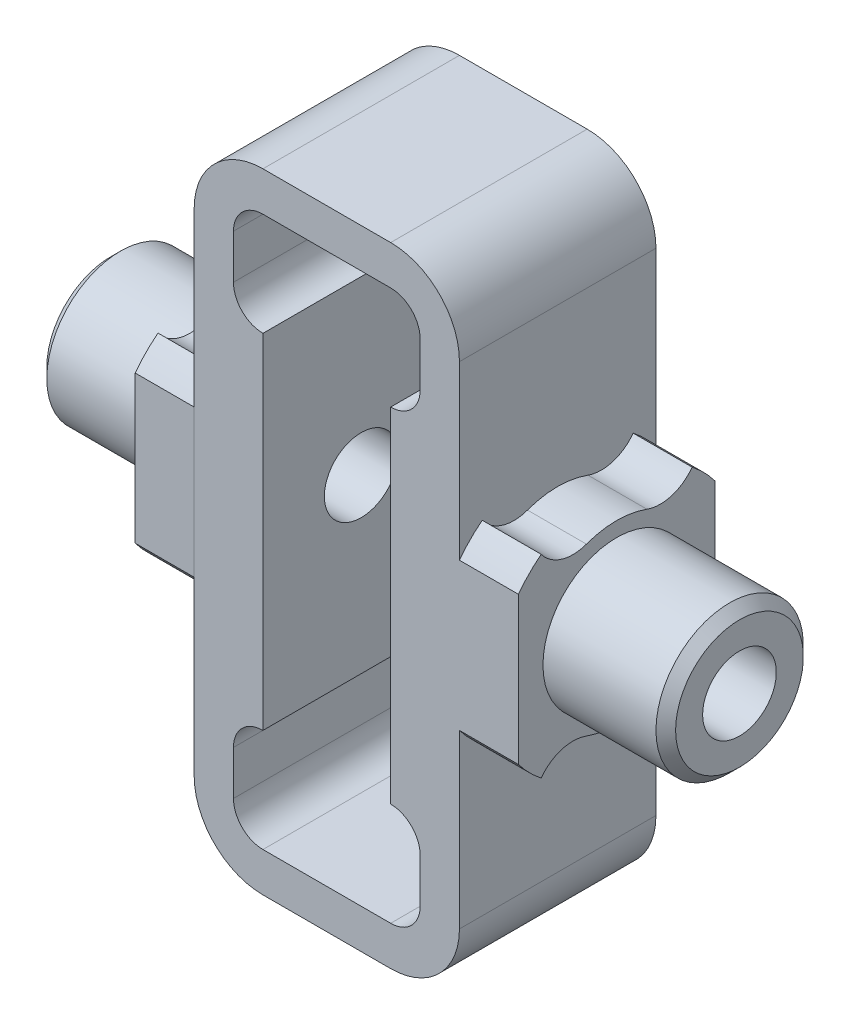
from build123d import *

# Parameters (mm, degrees)
BOSS_EXTRUDE1_DEPTH      = 20
CUT_EXTRUDE1_DEPTH       = 40
BOSS_EXTRUDE2_DEPTH      = 12
SKETCH5_R                = 15
BOSS_EXTRUDE3_DEPTH      = 25
CHAMFER1_SIZE            = 2
CHAMFER1_OF_MIRROR2_SIZE = 2


with BuildPart() as part:
    # Sketch1 → Boss-Extrude1 (new, symmetric)
    with BuildSketch(Plane.XY):
        with BuildLine():
            Line((0, 64), (-13, 64))
            ThreePointArc((-13, 64), (-22.899494937, 59.899494937), (-27, 50))
            Line((-27, 50), (-27, -50))
            ThreePointArc((-27, -50), (-22.899494937, -59.899494937), (-13, -64))
            Line((-13, -64), (0, -64))
            Line((0, -64), (0, 64))
        make_face()
    boss_extrude1 = extrude(amount=BOSS_EXTRUDE1_DEPTH, both=True)

    # Sketch2 → Cut-Extrude1 (cut)
    with BuildSketch(Plane.XY.offset(20)):
        with BuildLine():
            Line((-13, 35), (-13, -35))
            ThreePointArc((-13, -35), (-17.242640687, -36.757359313), (-19, -41))
            Line((-19, -41), (-19, -50))
            ThreePointArc((-19, -50), (-17.242640687, -54.242640687), (-13, -56))
            Line((-13, -56), (0, -56))
            Line((0, -56), (0, 56))
            Line((0, 56), (-13, 56))
            ThreePointArc((-13, 56), (-17.242640687, 54.242640687), (-19, 50))
            Line((-19, 50), (-19, 41))
            ThreePointArc((-19, 41), (-17.242640687, 36.757359313), (-13, 35))
        make_face()
    cut_extrude1 = extrude(amount=-CUT_EXTRUDE1_DEPTH, mode=Mode.SUBTRACT)

    # Mirror1: Boss-Extrude1, Cut-Extrude1 across plane
    add(boss_extrude1.mirror(Plane(origin=(0, 0, 0), x_dir=(0, 0, 1), z_dir=(1, 0, 0))))
    add(cut_extrude1.mirror(Plane(origin=(0, 0, 0), x_dir=(0, 0, 1), z_dir=(1, 0, 0))), mode=Mode.SUBTRACT)


with BuildPart() as body_2:
    # Sketch4 → Boss-Extrude2 (new body)
    with BuildSketch(Plane.ZY.offset(27)):
        with BuildLine():
            Line((20, 15), (20, -15))
            ThreePointArc((20, -15), (17.837457423, -17.516424084), (15.36071929, -19.724307412))
            ThreePointArc((15.36071929, -19.724307412), (11.22829357, -16.780591328), (6.15636258, -16.914467174))
            ThreePointArc((6.15636258, -16.914467174), (0, -18), (-6.15636258, -16.914467174))
            ThreePointArc((-6.15636258, -16.914467174), (-11.22829357, -16.780591328), (-15.36071929, -19.724307412))
            ThreePointArc((-15.36071929, -19.724307412), (-17.837457423, -17.516424084), (-20, -15))
            Line((-20, -15), (-20, 15))
            ThreePointArc((-20, 15), (-17.837457423, 17.516424084), (-15.36071929, 19.724307412))
            ThreePointArc((-15.36071929, 19.724307412), (-11.22829357, 16.780591328), (-6.15636258, 16.914467174))
            ThreePointArc((-6.15636258, 16.914467174), (0, 18), (6.15636258, 16.914467174))
            ThreePointArc((6.15636258, 16.914467174), (11.22829357, 16.780591328), (15.36071929, 19.724307412))
            ThreePointArc((15.36071929, 19.724307412), (17.837457423, 17.516424084), (20, 15))
        make_face()
    boss_extrude2 = extrude(amount=BOSS_EXTRUDE2_DEPTH)

    # Sketch5 → Boss-Extrude3 (add)
    with BuildSketch(Plane.ZY.offset(39)):
        Circle(SKETCH5_R)
    boss_extrude3 = extrude(amount=BOSS_EXTRUDE3_DEPTH)


with BuildPart() as f_15_0_15_diameter_hole1_tool:
    # Sketch7 → Ø15.0 (15) Diameter Hole1 (revolve)
    with BuildSketch(Plane(origin=(-64, 0, 0), x_dir=(0, 0, 1), z_dir=(0, 1, 0))):
        Polygon((0, 0), (0, 55.506454643), (7.5, 51), (7.5, 0), align=None)
    f_15_0_15_diameter_hole1 = revolve(axis=Axis((-70.35, 0, 0), (1, 0, 0)))


with BuildPart() as part_1:
    add(part.part)

    # Ø15.0 (15) Diameter Hole1: cut by f_15_0_15_diameter_hole1_tool
    add(f_15_0_15_diameter_hole1_tool.part, mode=Mode.SUBTRACT)

    # Mirror2: Boss-Extrude2, Boss-Extrude3, Ø15.0 (15) Diameter Hole1 across plane
    add(boss_extrude2.mirror(Plane(origin=(0, 0, 0), x_dir=(0, 0, 1), z_dir=(1, 0, 0))))
    add(boss_extrude3.mirror(Plane(origin=(0, 0, 0), x_dir=(0, 0, 1), z_dir=(1, 0, 0))))
    add(f_15_0_15_diameter_hole1.mirror(Plane(origin=(0, 0, 0), x_dir=(0, 0, 1), z_dir=(1, 0, 0))), mode=Mode.SUBTRACT)

    # Chamfer1 of Mirror2
    chamfer1_of_mirror2_edges = [part_1.edges().sort_by_distance(p)[0] for p in [
        (64, 0, -15),
    ]]
    chamfer(chamfer1_of_mirror2_edges, length=CHAMFER1_OF_MIRROR2_SIZE)


with BuildPart() as body_2_1:
    add(body_2.part)

    # Ø15.0 (15) Diameter Hole1: cut by f_15_0_15_diameter_hole1_tool
    add(f_15_0_15_diameter_hole1_tool.part, mode=Mode.SUBTRACT)

    # Chamfer1
    chamfer1_edges = [body_2_1.edges().sort_by_distance(p)[0] for p in [
        (-64, 0, -15),
    ]]
    chamfer(chamfer1_edges, length=CHAMFER1_SIZE)


solid = Compound([part_1.part, body_2_1.part])
